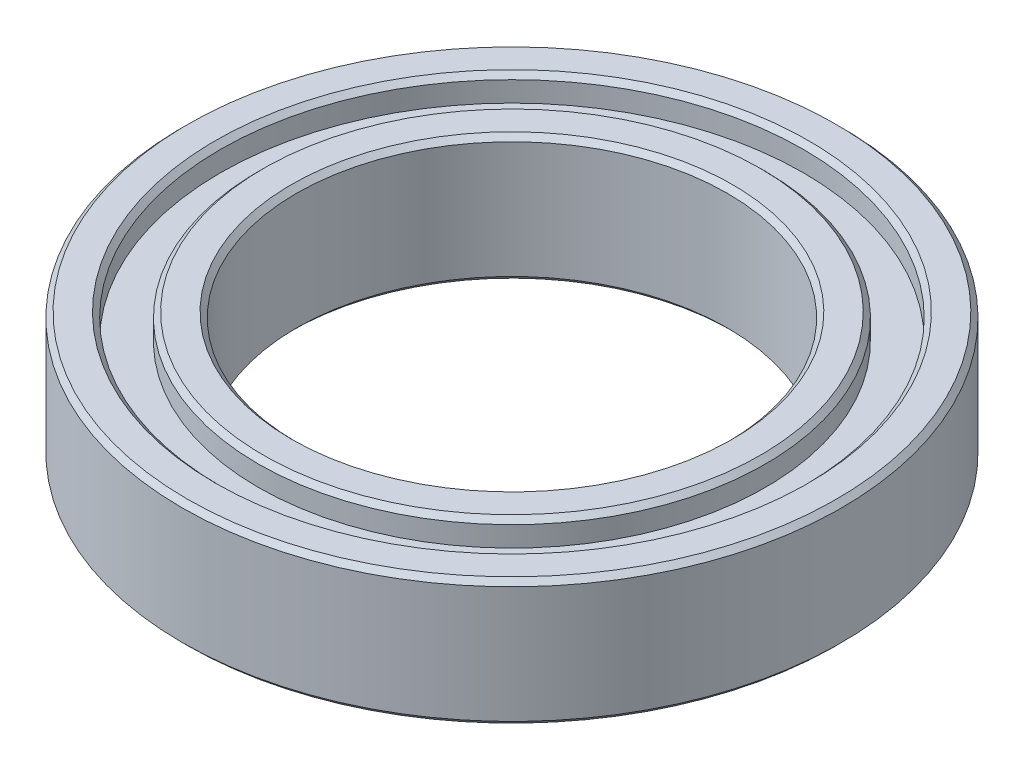
from build123d import *

# Parameters (mm, degrees)
SKETCH1_R           = 13
SKETCH1_R_2         = 8.5
BOSS_EXTRUDE1_DEPTH = 5
SKETCH2_R           = 11.5
SKETCH2_R_2         = 10
CUT_EXTRUDE1_DEPTH  = 1
CUT_EXTRUDE2_START  = -1
SKETCH3_R           = 11.5
SKETCH3_R_2         = 10
CUT_EXTRUDE2_DEPTH  = 1
CHAMFER1_SIZE       = 0.2


with BuildPart() as part:
    # Sketch1 → Boss-Extrude1 (new body)
    with BuildSketch(Plane(origin=(0, 0, 0), x_dir=(1, 0, 0), z_dir=(0, 1, 0))):
        with Locations(Location((0, 0, 0), (0, 0, 270))):
            Circle(SKETCH1_R)
        with Locations(Location((0, 0, 0), (0, 0, 270))):
            Circle(SKETCH1_R_2, mode=Mode.SUBTRACT)
    extrude(amount=BOSS_EXTRUDE1_DEPTH)

    # Sketch2 → Cut-Extrude1 (cut)
    with BuildSketch(Plane(origin=(0, 5, 0), x_dir=(1, 0, 0), z_dir=(0, 1, 0))):
        with Locations(Location((0, 0, 0), (0, 0, 270))):
            Circle(SKETCH2_R)
        with Locations(Location((0, 0, 0), (0, 0, 270))):
            Circle(SKETCH2_R_2, mode=Mode.SUBTRACT)
    extrude(amount=-CUT_EXTRUDE1_DEPTH, mode=Mode.SUBTRACT)

    # Sketch3 → Cut-Extrude2 (cut)
    with BuildSketch(Plane.XZ.offset(CUT_EXTRUDE2_START)):
        with Locations(Location((0, 0, 0), (0, 0, 90))):
            Circle(SKETCH3_R)
        with Locations(Location((0, 0, 0), (0, 0, 90))):
            Circle(SKETCH3_R_2, mode=Mode.SUBTRACT)
    extrude(amount=CUT_EXTRUDE2_DEPTH, mode=Mode.SUBTRACT)

    # Chamfer1
    chamfer1_edges = [part.edges().sort_by_distance(p)[0] for p in [
        (0, 5, -11.5),
        (0, 5, -10),
        (0, 0, -11.5),
        (0, 0, -13),
        (0, 0, -10),
        (0, 5, -13),
        (0, 0, -8.5),
        (0, 5, -8.5),
    ]]
    chamfer(chamfer1_edges, length=CHAMFER1_SIZE)


solid = part.part
